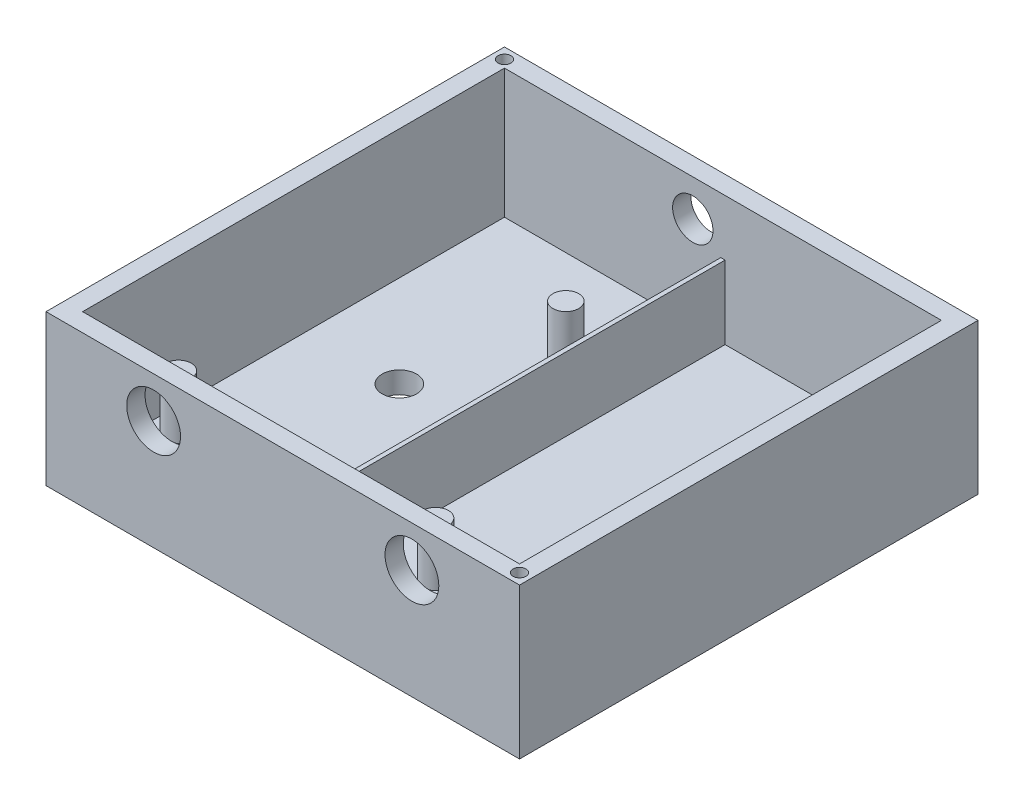
from build123d import *

# Parameters (mm, degrees)
SKETCH1_W           = 55.88
SKETCH1_H           = 54.102
BOSS_EXTRUDE1_DEPTH = 17.78
SKETCH3_W           = 51.562
SKETCH3_H           = 49.784
CUT_EXTRUDE1_DEPTH  = 15.24
SKETCH4_R           = 1.524
BOSS_EXTRUDE2_DEPTH = 6.35
SKETCH6_W           = 0.508
SKETCH6_H           = 49.784
BOSS_EXTRUDE3_DEPTH = 8.636
SKETCH7_R           = 3.175
CUT_EXTRUDE3_DEPTH  = 2.54
SKETCH8_R           = 2.38125
CUT_EXTRUDE5_DEPTH  = 2.54
SKETCH9_R           = 2.032
CUT_EXTRUDE6_DEPTH  = 2.54
SKETCH10_R          = 2.032
CUT_EXTRUDE7_DEPTH  = 2.54
SKETCH11_R          = 0.762
CUT_EXTRUDE8_DEPTH  = 49.276


with BuildPart() as part:
    # Sketch1 → Boss-Extrude1 (new body)
    with BuildSketch(Plane(origin=(0, 0, 0), x_dir=(1, 0, 0), z_dir=(0, 1, 0))):
        with Locations((27.94, 27.051)):
            Rectangle(SKETCH1_W, SKETCH1_H)
    extrude(amount=BOSS_EXTRUDE1_DEPTH)

    # Sketch3 → Cut-Extrude1 (cut)
    with BuildSketch(Plane(origin=(0, 17.78, 0), x_dir=(1, 0, 0), z_dir=(0, 1, 0))):
        with Locations((27.94, 27.051)):
            Rectangle(SKETCH3_W, SKETCH3_H)
    extrude(amount=-CUT_EXTRUDE1_DEPTH, mode=Mode.SUBTRACT)

    # Sketch4 → Boss-Extrude2 (add)
    with BuildSketch(Plane(origin=(0, 2.54, 0), x_dir=(1, 0, 0), z_dir=(0, 1, 0))):
        with Locations(Location((20.701, 40.64, 0), (0, 0, 270))):
            Circle(SKETCH4_R)
        with Locations(Location((4.953, 10.668, 0), (0, 0, 270))):
            Circle(SKETCH4_R)
        with Locations(Location((50.927, 40.767, 0), (0, 0, 270))):
            Circle(SKETCH4_R)
        with Locations(Location((35.179, 10.795, 0), (0, 0, 270))):
            Circle(SKETCH4_R)
    extrude(amount=BOSS_EXTRUDE2_DEPTH)

    # Sketch6 → Boss-Extrude3 (add)
    with BuildSketch(Plane(origin=(0, 2.54, 0), x_dir=(1, 0, 0), z_dir=(0, 1, 0))):
        with Locations((27.94, 27.051)):
            Rectangle(SKETCH6_W, SKETCH6_H)
    extrude(amount=BOSS_EXTRUDE3_DEPTH)

    # Sketch7 → Cut-Extrude3 (cut)
    with BuildSketch(Plane.XY):
        with Locations((12.7, 12.954)):
            Circle(SKETCH7_R)
        with Locations((43.18, 12.954)):
            Circle(SKETCH7_R)
    extrude(amount=-CUT_EXTRUDE3_DEPTH, mode=Mode.SUBTRACT)

    # Sketch8 → Cut-Extrude5 (cut)
    with BuildSketch(Plane(origin=(0, 0, -54.102), x_dir=(-1, 0, 0), z_dir=(0, 0, -1))):
        with Locations((-24.384, 13.462)):
            Circle(SKETCH8_R)
    extrude(amount=-CUT_EXTRUDE5_DEPTH, mode=Mode.SUBTRACT)

    # Sketch9 → Cut-Extrude6 (cut)
    with BuildSketch(Plane(origin=(0, 2.54, 0), x_dir=(1, 0, 0), z_dir=(0, 1, 0))):
        with Locations(Location((12.996559759, 28.702, 0), (0, 0, 270))):
            Circle(SKETCH9_R)
    extrude(amount=-CUT_EXTRUDE6_DEPTH, mode=Mode.SUBTRACT)

    # Sketch10 → Cut-Extrude7 (cut)
    with BuildSketch(Plane(origin=(0, 2.54, 0), x_dir=(1, 0, 0), z_dir=(0, 1, 0))):
        with Locations(Location((42.587559759, 28.702, 0), (0, 0, 270))):
            Circle(SKETCH10_R)
    extrude(amount=-CUT_EXTRUDE7_DEPTH, mode=Mode.SUBTRACT)

    # Sketch11 → Cut-Extrude8 (cut)
    with BuildSketch(Plane(origin=(0, 17.78, 0), x_dir=(1, 0, 0), z_dir=(0, 1, 0))):
        with Locations(Location((1.27, 52.832, 0), (0, 0, 270))):
            Circle(SKETCH11_R)
        with Locations(Location((54.61, 1.27, 0), (0, 0, 270))):
            Circle(SKETCH11_R)
    extrude(amount=-CUT_EXTRUDE8_DEPTH, mode=Mode.SUBTRACT)


solid = part.part
